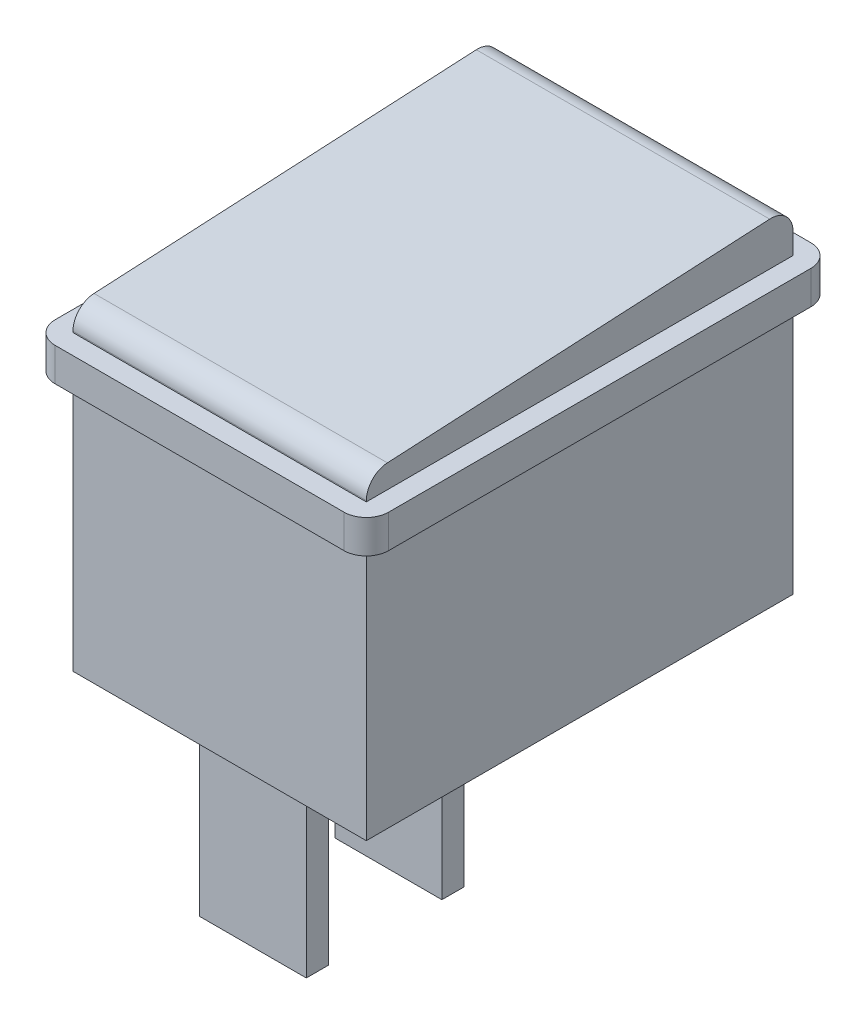
from build123d import *

# Parameters (mm, degrees)
SKETCH1_W           = 13.2
SKETCH1_H           = 19.2
BOSS_EXTRUDE1_DEPTH = 11.7
SKETCH2_W           = 15
SKETCH2_H           = 21
BOSS_EXTRUDE2_DEPTH = 1.5
SKETCH3_W           = 13.2
SKETCH3_H           = 19.2
BOSS_EXTRUDE3_DEPTH = 5
CUT_EXTRUDE1_DEPTH  = 13.2
SKETCH5_W           = 4.8
SKETCH5_H           = 1
BOSS_EXTRUDE4_DEPTH = 8.2
FILLET1_R           = 1


with BuildPart() as part:
    # Sketch1 → Boss-Extrude1 (new body)
    with BuildSketch(Plane(origin=(0, 0, 0), x_dir=(1, 0, 0), z_dir=(0, 1, 0))):
        Rectangle(SKETCH1_W, SKETCH1_H)
    extrude(amount=BOSS_EXTRUDE1_DEPTH)

    # Sketch2 → Boss-Extrude2 (add)
    with BuildSketch(Plane(origin=(0, 11.7, 0), x_dir=(1, 0, 0), z_dir=(0, 1, 0))):
        Rectangle(SKETCH2_W, SKETCH2_H)
    extrude(amount=BOSS_EXTRUDE2_DEPTH)

    # Sketch3 → Boss-Extrude3 (add)
    with BuildSketch(Plane(origin=(0, 13.2, 0), x_dir=(1, 0, 0), z_dir=(0, 1, 0))):
        Rectangle(SKETCH3_W, SKETCH3_H)
    extrude(amount=BOSS_EXTRUDE3_DEPTH)

    # Sketch4 → Cut-Extrude1 (cut)
    with BuildSketch(Plane(origin=(6.6, 0, 0), x_dir=(0, 0, -1), z_dir=(1, 0, 0))):
        Polygon((-9.6, 18.2), (-9.6, 15.7), (-9.6, 14.2), (9.6, 15.2), (9.6, 18.2), align=None)
    extrude(amount=-CUT_EXTRUDE1_DEPTH, mode=Mode.SUBTRACT)

    # Sketch5 → Boss-Extrude4 (add)
    with BuildSketch(Plane.XZ):
        with Locations((0, 1.5)):
            Rectangle(SKETCH5_W, SKETCH5_H)
        with Locations((0, 7.6)):
            Rectangle(SKETCH5_W, SKETCH5_H)
    extrude(amount=BOSS_EXTRUDE4_DEPTH)

    # Fillet1
    fillet1_edges = [part.edges().sort_by_distance(p)[0] for p in [
        (7.5, 12.45, 10.5),
        (7.5, 12.45, -10.5),
        (-7.5, 12.45, -10.5),
        (-7.5, 12.45, 10.5),
        (0, 15.2, -9.6),
        (0, 14.2, 9.6),
    ]]
    fillet(fillet1_edges, radius=FILLET1_R)


solid = part.part
